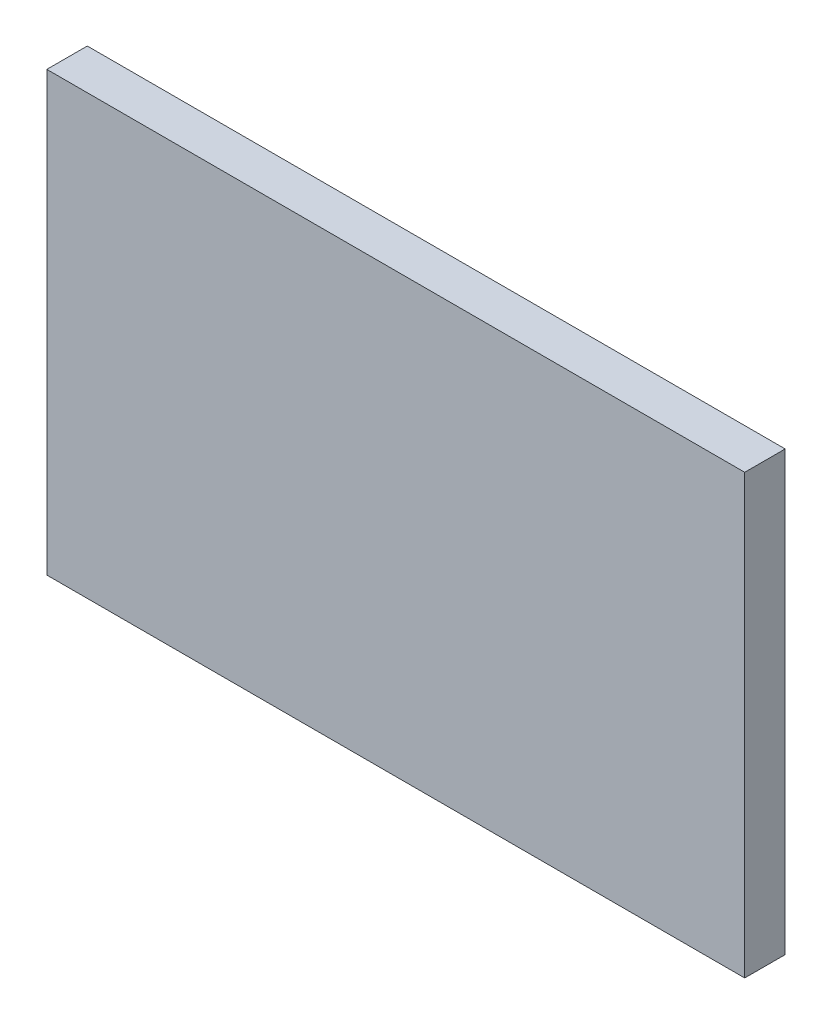
from build123d import *

# Parameters (mm, degrees)
ESBO_O1_W                = 17.25
ESBO_O1_H                = 10.825317547
RESSALTO_EXTRUS_O1_DEPTH = 1


with BuildPart() as part:
    # Esboço1 → Ressalto-extrusão1 (new body)
    with BuildSketch(Plane.XY):
        with Locations((-50.290114297, 36.527540492)):
            Rectangle(ESBO_O1_W, ESBO_O1_H)
    extrude(amount=RESSALTO_EXTRUS_O1_DEPTH)


solid = part.part
